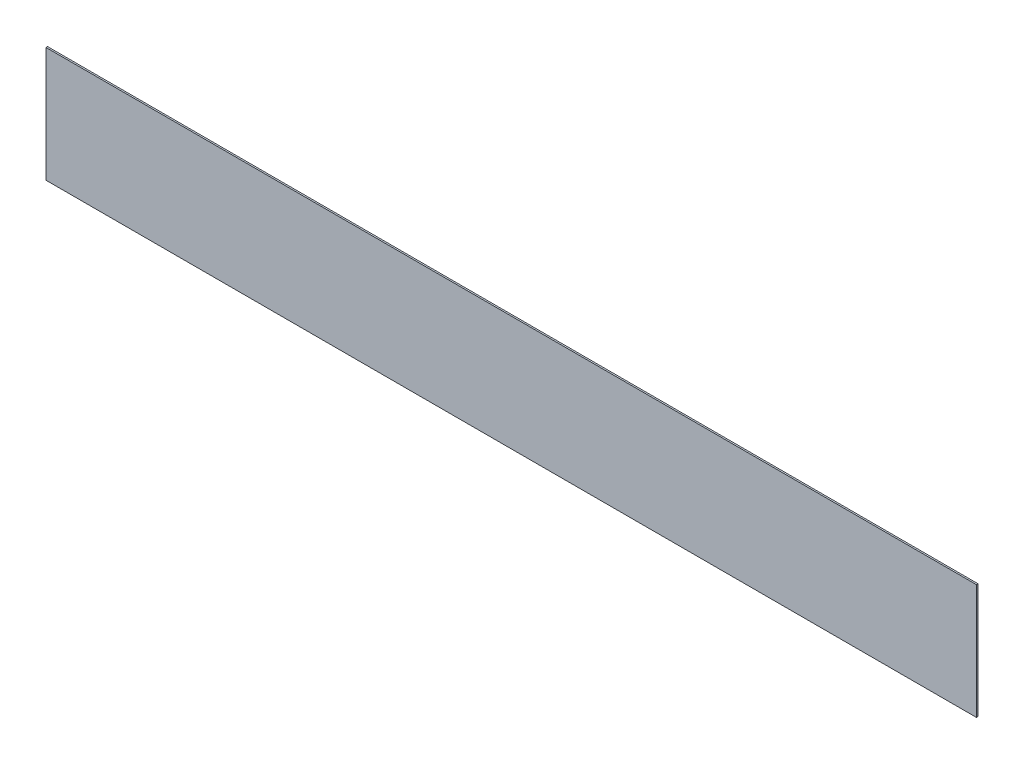
from build123d import *

# Parameters (mm, degrees)
CEK_TAZE_KUTU_ARKA_1_0_1_START = -699
SKETCH1_W                      = 590.6
SKETCH1_H                      = 73
CEK_TAZE_KUTU_ARKA_1_0_1_DEPTH = 1


with BuildPart() as part:
    # Sketch1 → CEK_taze_kutu_arka_1.0_1 (new body)
    with BuildSketch(Plane.XY.offset(CEK_TAZE_KUTU_ARKA_1_0_1_START)):
        with Locations((309, 44.5)):
            Rectangle(SKETCH1_W, SKETCH1_H)
    extrude(amount=-CEK_TAZE_KUTU_ARKA_1_0_1_DEPTH)


solid = part.part
